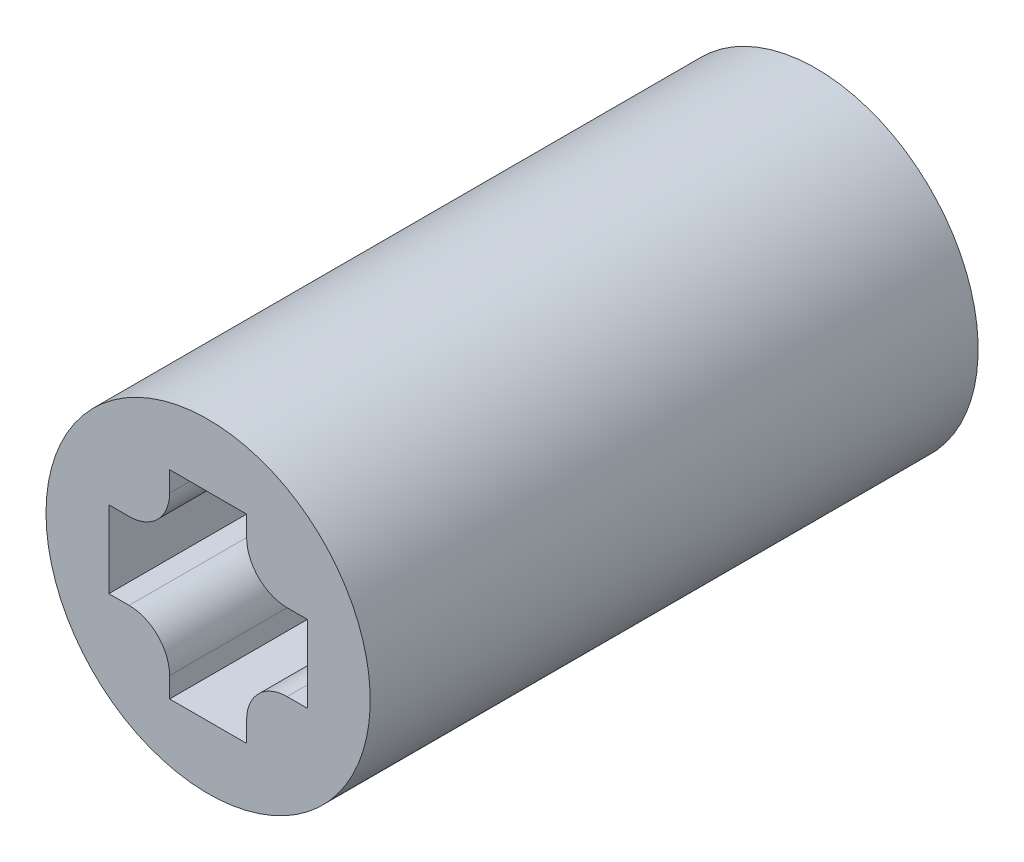
from build123d import *

# Parameters (mm, degrees)
SKETCH1_R           = 4.5
BOSS_EXTRUDE1_DEPTH = 15
SKETCH2_W           = 4
SKETCH2_H           = 6
CUT_EXTRUDE1_DEPTH  = 7
CUT_EXTRUDE2_DEPTH  = 7
FILLET3_R           = 1
FILLET4_R           = 0.9
SKETCH4_R           = 4.5
SKETCH4_R_2         = 4
CUT_EXTRUDE3_DEPTH  = 15
SKETCH6_W           = 9.329019204
SKETCH6_H           = 8.683838676
SKETCH6_W_2         = 5
SKETCH6_H_2         = 7
CUT_EXTRUDE4_DEPTH  = 7
BOSS_EXTRUDE2_START = -15
SKETCH7_R           = 4
SKETCH7_R_2         = 3.5
BOSS_EXTRUDE2_DEPTH = 15
SKETCH8_W           = 7.8
SKETCH8_H           = 4.898979486
BOSS_EXTRUDE3_DEPTH = 1
SKETCH9_W           = 7.7
SKETCH9_H           = 5
BOSS_EXTRUDE4_DEPTH = 1
SKETCH10_R          = 4.498846738
SKETCH10_R_2        = 4
CUT_EXTRUDE7_DEPTH  = 21


with BuildPart() as part:
    # Sketch1 → Boss-Extrude1 (new body)
    with BuildSketch(Plane.XY):
        Circle(SKETCH1_R)
    extrude(amount=BOSS_EXTRUDE1_DEPTH)

    # Sketch2 → Cut-Extrude1 (cut)
    with BuildSketch(Plane(origin=(0, 0, 0), x_dir=(-1, 0, 0), z_dir=(0, 0, -1))):
        Rectangle(SKETCH2_W, SKETCH2_H)
    extrude(amount=-CUT_EXTRUDE1_DEPTH, mode=Mode.SUBTRACT)

    # Sketch3 → Cut-Extrude2 (cut)
    with BuildSketch(Plane.XY.offset(15)):
        Polygon((-0.95, -0.95), (-0.95, -2.45), (0.95, -2.45), (0.95, -0.95), (2.45, -0.95), (2.45, 0.95), (0.95, 0.95), (0.95, 2.45), (-0.95, 2.45), (-0.95, 0.95), (-2.45, 0.95), (-2.45, -0.95), align=None)
    extrude(amount=-CUT_EXTRUDE2_DEPTH, mode=Mode.SUBTRACT)

    # Fillet3
    fillet3_edges = [part.edges().sort_by_distance(p)[0] for p in [
        (0.95, -0.95, 11.5),
        (-0.95, -0.95, 11.5),
        (-0.95, 0.95, 11.5),
        (0.95, 0.95, 11.5),
    ]]
    fillet(fillet3_edges, radius=FILLET3_R)

    # Fillet4
    fillet4_edges = [part.edges().sort_by_distance(p)[0] for p in [
        (-2, 3, 3.5),
        (-2, -3, 3.5),
        (2, -3, 3.5),
        (2, 3, 3.5),
    ]]
    fillet(fillet4_edges, radius=FILLET4_R)

    # Sketch4 → Cut-Extrude3 (cut)
    with BuildSketch(Plane(origin=(0, 0, 0), x_dir=(-1, 0, 0), z_dir=(0, 0, -1))):
        Circle(SKETCH4_R)
        Circle(SKETCH4_R_2, mode=Mode.SUBTRACT)
    extrude(amount=-CUT_EXTRUDE3_DEPTH, mode=Mode.SUBTRACT)

    # Sketch6 → Cut-Extrude4 (cut)
    with BuildSketch(Plane(origin=(0, 0, 0), x_dir=(-1, 0, 0), z_dir=(0, 0, -1))):
        Rectangle(SKETCH6_W, SKETCH6_H)
        Rectangle(SKETCH6_W_2, SKETCH6_H_2, mode=Mode.SUBTRACT)
    extrude(amount=-CUT_EXTRUDE4_DEPTH, mode=Mode.SUBTRACT)

    # Sketch7 → Boss-Extrude2 (add)
    with BuildSketch(Plane.XY.offset(15).offset(BOSS_EXTRUDE2_START)):
        with Locations(Location((0, 0, 0), (0, 0, 180))):
            Circle(SKETCH7_R)
        Circle(SKETCH7_R_2, mode=Mode.SUBTRACT)
    extrude(amount=BOSS_EXTRUDE2_DEPTH)

    # Sketch8 → Boss-Extrude3 (add)
    with BuildSketch(Plane(origin=(2.5, 0, 0), x_dir=(0, 0, -1), z_dir=(1, 0, 0))):
        with Locations((-3.9, 0)):
            Rectangle(SKETCH8_W, SKETCH8_H)
    extrude(amount=BOSS_EXTRUDE3_DEPTH)

    # Sketch9 → Boss-Extrude4 (add)
    with BuildSketch(Plane.ZY.offset(2.5)):
        with Locations((3.85, -0.050510257)):
            Rectangle(SKETCH9_W, SKETCH9_H)
    extrude(amount=BOSS_EXTRUDE4_DEPTH)

    # Sketch10 → Cut-Extrude7 (cut)
    with BuildSketch(Plane(origin=(0, 0, 0), x_dir=(-1, 0, 0), z_dir=(0, 0, -1))):
        Circle(SKETCH10_R)
        Circle(SKETCH10_R_2, mode=Mode.SUBTRACT)
    extrude(amount=-CUT_EXTRUDE7_DEPTH, mode=Mode.SUBTRACT)


solid = part.part
